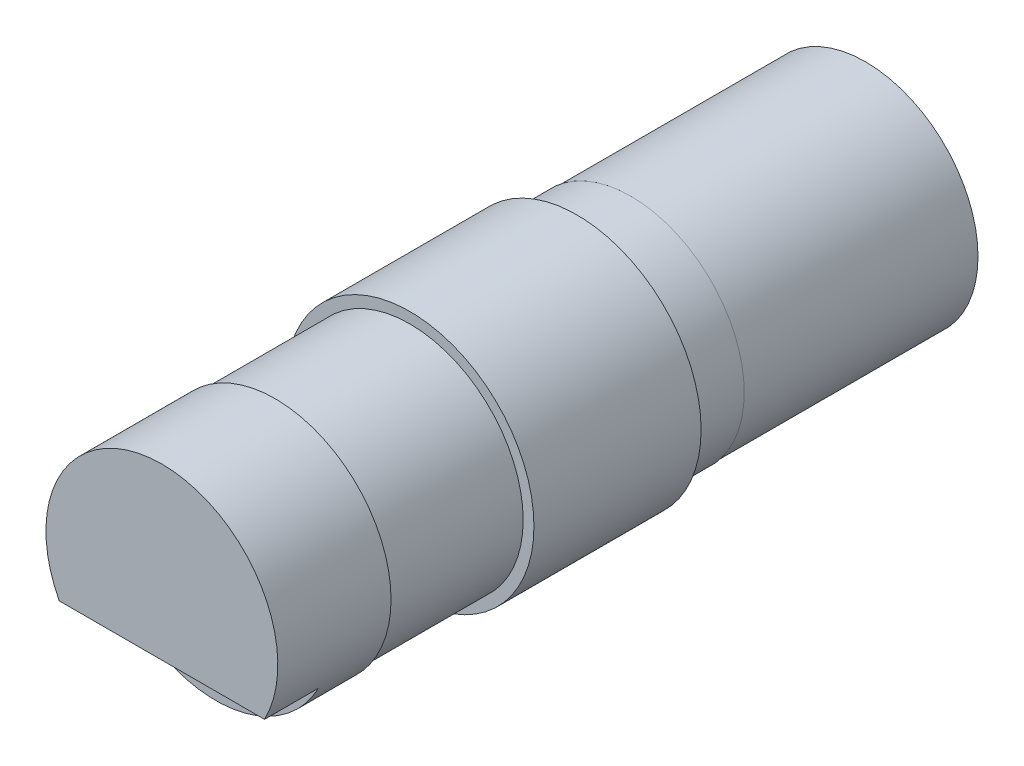
from build123d import *

# Parameters (mm, degrees)
SKETCH1_R           = 21
BOSS_EXTRUDE1_DEPTH = 25
SKETCH2_R           = 23
BOSS_EXTRUDE2_DEPTH = 31
SKETCH3_R           = 21
BOSS_EXTRUDE3_DEPTH = 10
SKETCH4_R           = 20.85
BOSS_EXTRUDE4_DEPTH = 43.5
SKETCH5_R           = 13
BOSS_EXTRUDE5_DEPTH = 2
SKETCH6_R           = 4
CUT_EXTRUDE1_DEPTH  = 3
SKETCH7_R           = 21.5
BOSS_EXTRUDE6_DEPTH = 21
CUT_EXTRUDE2_START  = -10
CUT_EXTRUDE2_DEPTH  = 10
SKETCH9_R           = 2
CUT_EXTRUDE3_DEPTH  = 7


with BuildPart() as part:
    # Sketch1 → Boss-Extrude1 (new body)
    with BuildSketch(Plane.XY):
        Circle(SKETCH1_R)
    extrude(amount=-BOSS_EXTRUDE1_DEPTH)

    # Sketch2 → Boss-Extrude2 (add)
    with BuildSketch(Plane(origin=(0, 0, -25), x_dir=(-1, 0, 0), z_dir=(0, 0, -1))):
        Circle(SKETCH2_R)
    extrude(amount=BOSS_EXTRUDE2_DEPTH)

    # Sketch3 → Boss-Extrude3 (add)
    with BuildSketch(Plane(origin=(0, 0, -56), x_dir=(-1, 0, 0), z_dir=(0, 0, -1))):
        with Locations(Location((0, 0, 0), (0, 0, 180))):
            Circle(SKETCH3_R)
    extrude(amount=BOSS_EXTRUDE3_DEPTH)

    # Sketch4 → Boss-Extrude4 (add)
    with BuildSketch(Plane(origin=(0, 0, -66), x_dir=(-1, 0, 0), z_dir=(0, 0, -1))):
        Circle(SKETCH4_R)
    extrude(amount=BOSS_EXTRUDE4_DEPTH)

    # Sketch5 → Boss-Extrude5 (add)
    with BuildSketch(Plane(origin=(0, 0, -109.5), x_dir=(-1, 0, 0), z_dir=(0, 0, -1))):
        Circle(SKETCH5_R)
    extrude(amount=BOSS_EXTRUDE5_DEPTH)

    # Sketch6 → Cut-Extrude1 (cut)
    with BuildSketch(Plane(origin=(0, 0, -111.5), x_dir=(-1, 0, 0), z_dir=(0, 0, -1))):
        Circle(SKETCH6_R)
    extrude(amount=-CUT_EXTRUDE1_DEPTH, mode=Mode.SUBTRACT)

    # Sketch7 → Boss-Extrude6 (add)
    with BuildSketch(Plane.XY):
        with Locations(Location((0, 0, 0), (0, 0, 180))):
            Circle(SKETCH7_R)
    extrude(amount=BOSS_EXTRUDE6_DEPTH)

    # Sketch8 → Cut-Extrude2 (cut)
    with BuildSketch(Plane.XY.offset(21).offset(CUT_EXTRUDE2_START)):
        with BuildLine():
            Line((-19.032866311, -10), (19.032866311, -10))
            ThreePointArc((19.032866311, -10), (0, -21.5), (-19.032866311, -10))
        make_face()
    extrude(amount=CUT_EXTRUDE2_DEPTH, mode=Mode.SUBTRACT)

    # Sketch9 → Cut-Extrude3 (cut)
    with BuildSketch(Plane(origin=(0, 0, -109.5), x_dir=(-1, 0, 0), z_dir=(0, 0, -1))):
        with Locations((0, 17.5)):
            Circle(SKETCH9_R)
        with Locations((17.5, 0)):
            Circle(SKETCH9_R)
        with Locations((0, -17.5)):
            Circle(SKETCH9_R)
        with Locations((-17.5, 0)):
            Circle(SKETCH9_R)
    extrude(amount=-CUT_EXTRUDE3_DEPTH, mode=Mode.SUBTRACT)


solid = part.part
